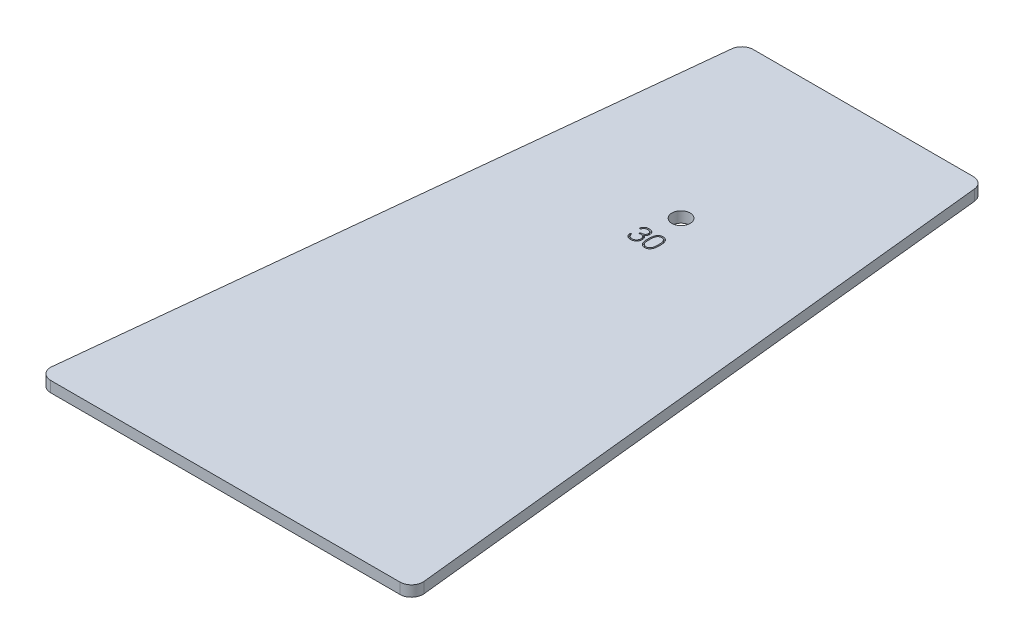
from build123d import *

# Parameters (mm, degrees)
BOSS_EXTRUDE1_DEPTH = 5.9944
SKETCH2_R           = 5.08
CUT_EXTRUDE1_DEPTH  = 371.66580688
CUT_EXTRUDE2_DEPTH  = 1.27
FILLET1_R           = 6.35


with BuildPart() as part:
    # Sketch1 → Boss-Extrude1 (new body)
    with BuildSketch(Plane(origin=(0, 0, 0), x_dir=(1, 0, 0), z_dir=(0, 1, 0))):
        Polygon((-67.056, 0), (67.056, 0), (104.43106606, -355.6), (-104.43106606, -355.6), align=None)
    extrude(amount=BOSS_EXTRUDE1_DEPTH)

    # Sketch2 → Cut-Extrude1 (cut, through all)
    with BuildSketch(Plane(origin=(0, 5.9944, 0), x_dir=(1, 0, 0), z_dir=(0, 1, 0))):
        with Locations(Location((0, -101.6, 0), (0, 0, 270))):
            Circle(SKETCH2_R)
    extrude(amount=-CUT_EXTRUDE1_DEPTH, mode=Mode.SUBTRACT)

    # Sketch3 → Cut-Extrude2 (cut)
    # profile 1 of 2: a face of its own
    with BuildSketch(Plane(origin=(0, 5.9944, 0), x_dir=(1, 0, 0), z_dir=(0, 1, 0))):
        with BuildLine():
            Line((-7.022352941, -123.068602941), (-6.225490196, -122.940980392))
            add(Edge.make_bspline(
                [(-6.225490196, -122.940980392), (-6.179159168, -123.113672862), (-6.090766085, -123.443145791), (-5.893002314, -123.893116495), (-5.653326656, -124.277637163), (-5.362735748, -124.592717125), (-5.023623342, -124.836847536), (-4.639439373, -125.009559122), (-4.210900555, -125.114996328), (-3.91023845, -125.126417063), (-3.753970588, -125.132352941)],
                knots=[0, 0, 0, 0, 1.185952709, 2.262630877, 3.250838064, 4.182033203, 5.090336224, 6.006134824, 6.963696984, 8, 8, 8, 8], degree=3))
            add(Edge.make_bspline(
                [(-3.753970588, -125.132352941), (-3.632311974, -125.129294556), (-3.396778139, -125.123373454), (-3.055537122, -125.062438499), (-2.739613531, -124.962860022), (-2.44676451, -124.825432627), (-2.1842903, -124.650311606), (-1.946018921, -124.449446481), (-1.740349543, -124.216617453), (-1.561552955, -123.957580623), (-1.416849481, -123.67148988), (-1.319432673, -123.358844856), (-1.253270796, -123.026773567), (-1.247865406, -122.79709633), (-1.245098039, -122.679509804)],
                knots=[0, 0, 0, 0, 1.112391676, 2.1536155, 3.159607968, 4.13650094, 5.103002125, 6.039177095, 6.980681787, 7.936725385, 8.913387604, 9.901293339, 10.925537295, 12, 12, 12, 12], degree=3))
            add(Edge.make_bspline(
                [(-1.245098039, -122.679509804), (-1.246477833, -122.600522673), (-1.249194291, -122.445017372), (-1.282695151, -122.219426954), (-1.327451026, -122.004938691), (-1.396057418, -121.803943287), (-1.489048405, -121.617377102), (-1.592290807, -121.437763337), (-1.722685616, -121.275763034), (-1.917485463, -121.076343486), (-2.20188298, -120.864069311), (-2.593312238, -120.677013181), (-3.036743624, -120.571255612), (-3.346678027, -120.557536056), (-3.508063725, -120.550392157)],
                knots=[0, 0, 0, 0, 0.811772018, 1.598169866, 2.341374635, 3.06367051, 3.774921333, 4.483283491, 5.190035732, 5.907028974, 7.347870326, 8.813481259, 10.340750343, 12, 12, 12, 12], degree=3))
            add(Edge.make_bspline(
                [(-3.508063725, -120.550392157), (-3.570458136, -120.553211168), (-3.706544321, -120.55935961), (-3.923959231, -120.600132932), (-4.170366976, -120.662415604), (-4.34159116, -120.719358558), (-4.43254902, -120.749607843)],
                knots=[0, 0, 0, 0, 0.788647944, 1.720091416, 2.788864984, 4, 4, 4, 4], degree=3))
            Line((-4.43254902, -120.749607843), (-4.339166667, -119.952745098))
            add(Edge.make_bspline(
                [(-4.339166667, -119.952745098), (-4.211491436, -119.950936246), (-3.969367573, -119.947505931), (-3.628545312, -119.922817047), (-3.330265399, -119.885264194), (-3.000954361, -119.807625151), (-2.646422183, -119.674933754), (-2.338322284, -119.490885157), (-2.131152352, -119.319361376), (-1.999871604, -119.178734556), (-1.890363345, -119.027511909), (-1.797899612, -118.86789123), (-1.729210893, -118.693480512), (-1.681209143, -118.508345213), (-1.647346728, -118.311468027), (-1.644829413, -118.176557999), (-1.643529412, -118.106887255)],
                knots=[0, 0, 0, 0, 1.451240035, 2.752137916, 3.88312397, 4.8644669, 6.592895175, 8.164668079, 8.918269139, 9.644320432, 10.345018353, 11.037025267, 11.735734825, 12.468177286, 13.208930344, 14, 14, 14, 14], degree=3))
            add(Edge.make_bspline(
                [(-1.643529412, -118.106887255), (-1.650509345, -117.983610579), (-1.66411437, -117.743324277), (-1.776821399, -117.401046126), (-1.96596106, -117.098265223), (-2.224892561, -116.840701279), (-2.536214171, -116.629020004), (-2.893116827, -116.475476622), (-3.290761262, -116.383395594), (-3.568768596, -116.372523158), (-3.713504902, -116.366862745)],
                knots=[0, 0, 0, 0, 0.976737165, 1.903819668, 2.824737209, 3.785549291, 4.781400884, 5.79567262, 6.852382064, 8, 8, 8, 8], degree=3))
            add(Edge.make_bspline(
                [(-3.713504902, -116.366862745), (-3.854039415, -116.371791417), (-4.12537475, -116.381307391), (-4.513600015, -116.467110178), (-4.865095935, -116.607514109), (-5.17833718, -116.807215106), (-5.453425475, -117.062995686), (-5.684159559, -117.378756965), (-5.883219335, -117.745828774), (-5.97729652, -118.018070701), (-6.02627451, -118.159803922)],
                knots=[0, 0, 0, 0, 1.063244, 2.052845668, 2.994088376, 3.916241797, 4.850371738, 5.821675903, 6.865931876, 8, 8, 8, 8], degree=3))
            Line((-6.02627451, -118.159803922), (-6.823137255, -118.007279412))
            add(Edge.make_bspline(
                [(-6.823137255, -118.007279412), (-6.795507069, -117.908263802), (-6.741395917, -117.714350929), (-6.638235475, -117.438000328), (-6.521644051, -117.180742974), (-6.39619017, -116.940453145), (-6.251608562, -116.72101519), (-6.09249965, -116.521665128), (-5.920815848, -116.340294928), (-5.736152715, -116.176736099), (-5.535865927, -116.032888014), (-5.320569348, -115.908978205), (-5.093111316, -115.802051694), (-4.850790057, -115.717919709), (-4.594226042, -115.653756692), (-4.324277726, -115.602706227), (-4.039873378, -115.575380927), (-3.846367498, -115.571816599), (-3.747745098, -115.57)],
                knots=[0, 0, 0, 0, 1.151946065, 2.255979367, 3.302323512, 4.316963809, 5.291200695, 6.243031876, 7.172717729, 8.087440795, 9.004158252, 9.931804679, 10.868449138, 11.817504777, 12.802032331, 13.83090576, 14.894497265, 16, 16, 16, 16], degree=3))
            add(Edge.make_bspline(
                [(-3.747745098, -115.57), (-3.640762164, -115.571134578), (-3.431393848, -115.573354975), (-3.126775673, -115.609879124), (-2.837313267, -115.662151303), (-2.56322677, -115.734994388), (-2.307835885, -115.836020829), (-2.068092886, -115.955485342), (-1.843673392, -116.09447094), (-1.638127063, -116.257539882), (-1.451493202, -116.43696588), (-1.287791849, -116.633237344), (-1.153981272, -116.848271897), (-1.040592711, -117.075951667), (-0.953424076, -117.320547421), (-0.891547543, -117.580392137), (-0.853370675, -117.855698039), (-0.848936049, -118.044506384), (-0.846666667, -118.141127451)],
                knots=[0, 0, 0, 0, 1.17304118, 2.295671334, 3.360722231, 4.399095647, 5.401139445, 6.368437906, 7.334999225, 8.291519651, 9.241514563, 10.171449278, 11.087342197, 12.013926289, 12.957350552, 13.929260155, 14.940316477, 16, 16, 16, 16], degree=3))
            add(Edge.make_bspline(
                [(-0.846666667, -118.141127451), (-0.850930579, -118.256558068), (-0.859217004, -118.480884227), (-0.92146644, -118.80693692), (-1.031917246, -119.107338687), (-1.182879951, -119.386249798), (-1.379156133, -119.63939225), (-1.614751692, -119.87329668), (-1.897947491, -120.078496141), (-2.108008459, -120.192705027), (-2.21627451, -120.251568627)],
                knots=[0, 0, 0, 0, 1.039153621, 2.01947583, 2.9741737, 3.910731788, 4.863782364, 5.848192228, 6.890951849, 8, 8, 8, 8], degree=3))
            add(Edge.make_bspline(
                [(-2.21627451, -120.251568627), (-2.076605097, -120.297135403), (-1.806544353, -120.385242005), (-1.440808729, -120.58262141), (-1.133728819, -120.830069975), (-0.877589438, -121.120636681), (-0.685343201, -121.463379276), (-0.543367347, -121.847361186), (-0.463326152, -122.278848212), (-0.453422318, -122.580608394), (-0.448235294, -122.738651961)],
                knots=[0, 0, 0, 0, 1.062050142, 2.053549488, 2.988468085, 3.904211674, 4.839582746, 5.816291321, 6.856306669, 8, 8, 8, 8], degree=3))
            add(Edge.make_bspline(
                [(-0.448235294, -122.738651961), (-0.451291104, -122.855014514), (-0.457288258, -123.083380833), (-0.502478751, -123.417657966), (-0.571377301, -123.735672586), (-0.676738803, -124.034186175), (-0.807153117, -124.316876649), (-0.969873616, -124.581571508), (-1.160792719, -124.828915505), (-1.379109975, -125.056141259), (-1.620394131, -125.260207248), (-1.881430984, -125.438882746), (-2.157648032, -125.592689762), (-2.454217209, -125.713387607), (-2.766248092, -125.811407575), (-3.097158213, -125.877287666), (-3.444464768, -125.924350599), (-3.682208492, -125.927569671), (-3.80377451, -125.929215686)],
                knots=[0, 0, 0, 0, 1.072071369, 2.103984363, 3.103853144, 4.0655425, 5.015271866, 5.96812527, 6.922560812, 7.8897021, 8.866767387, 9.829597087, 10.801124953, 11.774298562, 12.775446883, 13.810677578, 14.880528982, 16, 16, 16, 16], degree=3))
            add(Edge.make_bspline(
                [(-3.80377451, -125.929215686), (-3.91174159, -125.926380954), (-4.121899618, -125.920863145), (-4.430362418, -125.890720053), (-4.721742092, -125.834404654), (-4.998637664, -125.757502141), (-5.256115535, -125.653715683), (-5.499932286, -125.53163902), (-5.726545074, -125.385760493), (-5.936578214, -125.215939691), (-6.130179855, -125.024934126), (-6.30864799, -124.813174484), (-6.467563012, -124.575955577), (-6.614344715, -124.318893999), (-6.741149501, -124.036717645), (-6.852809332, -123.733950277), (-6.950758779, -123.410032489), (-6.998114815, -123.184193544), (-7.022352941, -123.068602941)],
                knots=[0, 0, 0, 0, 1.092142754, 2.125856941, 3.130178579, 4.090157876, 5.027443808, 5.933183123, 6.844256067, 7.747255784, 8.659958934, 9.591056537, 10.542798976, 11.543715938, 12.581523217, 13.667244669, 14.806031458, 16, 16, 16, 16], degree=3))
        make_face()
    # profile 2 of 2: a face of its own
    with BuildSketch(Plane(origin=(0, 5.9944, 0), x_dir=(1, 0, 0), z_dir=(0, 1, 0))):
        with BuildLine():
            add(Edge.make_bspline(
                [(7.321176471, -120.755833333), (7.318828398, -120.964435203), (7.314268428, -121.369541156), (7.278053355, -121.956745016), (7.212590307, -122.503235643), (7.123658685, -123.008755237), (7.008266172, -123.474678786), (6.871087333, -123.902056716), (6.702092819, -124.287425995), (6.508215245, -124.632617465), (6.291747836, -124.939879658), (6.045192851, -125.205053414), (5.774903263, -125.430333986), (5.47658793, -125.612983557), (5.154255704, -125.75891836), (4.803074469, -125.854617169), (4.428855706, -125.921386338), (4.17035965, -125.926554175), (4.037230392, -125.929215686)],
                knots=[0, 0, 0, 0, 1.444951835, 2.806104229, 4.07292158, 5.255788138, 6.359234241, 7.395665143, 8.361159583, 9.268708362, 10.134304339, 10.95819393, 11.769860228, 12.563733626, 13.374508403, 14.211708464, 15.079003648, 16, 16, 16, 16], degree=3))
            add(Edge.make_bspline(
                [(4.037230392, -125.929215686), (3.904173743, -125.926129436), (3.644961099, -125.920116997), (3.27017657, -125.859085315), (2.920411161, -125.763594373), (2.59640029, -125.625895969), (2.300139806, -125.446021212), (2.024069589, -125.233082993), (1.778627689, -124.975727427), (1.560171839, -124.679785297), (1.365195047, -124.347714828), (1.20253453, -123.973246068), (1.058366082, -123.562916679), (0.945634561, -123.112374896), (0.854092493, -122.625055928), (0.795691583, -122.097466824), (0.752427723, -121.531621273), (0.748884772, -121.140869167), (0.747058824, -120.939485294)],
                knots=[0, 0, 0, 0, 0.942187573, 1.835510922, 2.682899358, 3.50644207, 4.321041037, 5.132947656, 5.970162763, 6.831912057, 7.734836617, 8.692673853, 9.720484412, 10.813675431, 11.980358204, 13.231647047, 14.573260056, 16, 16, 16, 16], degree=3))
            add(Edge.make_bspline(
                [(0.747058824, -120.939485294), (0.749189738, -120.709081181), (0.753301018, -120.264550974), (0.791785956, -119.623892076), (0.848921011, -119.033607435), (0.931327178, -118.493626742), (1.041809864, -118.002956136), (1.18209133, -117.562748274), (1.344352733, -117.168906906), (1.542969603, -116.826611164), (1.76640963, -116.527719309), (2.011736134, -116.265404707), (2.288722816, -116.05041743), (2.588716504, -115.873144616), (2.914180915, -115.735469097), (3.266151279, -115.640569114), (3.642854433, -115.578856283), (3.90312556, -115.573011518), (4.037230392, -115.57)],
                knots=[0, 0, 0, 0, 1.545108237, 2.981054794, 4.302900454, 5.52134946, 6.64223763, 7.672189641, 8.617001291, 9.493094031, 10.318410963, 11.115795503, 11.893970542, 12.661367534, 13.447190288, 14.255881535, 15.101342067, 16, 16, 16, 16], degree=3))
            add(Edge.make_bspline(
                [(4.037230392, -115.57), (4.170238627, -115.57448963), (4.428282356, -115.583199774), (4.804192318, -115.642018007), (5.152618043, -115.745772402), (5.478653289, -115.884356647), (5.772542755, -116.073295118), (6.047681503, -116.293496105), (6.289327541, -116.562467111), (6.510315761, -116.867199073), (6.701841879, -117.215226558), (6.869820244, -117.601739646), (7.009467972, -118.029371708), (7.123413066, -118.496780378), (7.21266615, -119.005311375), (7.277684225, -119.552884468), (7.314472673, -120.141074122), (7.318890361, -120.546189931), (7.321176471, -120.755833333)],
                knots=[0, 0, 0, 0, 0.919968977, 1.784793451, 2.622728724, 3.429378823, 4.225844794, 5.031728358, 5.85964663, 6.718105312, 7.630541726, 8.601153045, 9.629202519, 10.737948011, 11.926092541, 13.198121829, 14.550055913, 16, 16, 16, 16], degree=3))
        make_face()
        with BuildLine():
            add(Edge.make_bspline(
                [(6.524313725, -120.768284314), (6.522566947, -120.59082563), (6.519183425, -120.247086842), (6.491882586, -119.747351272), (6.442379883, -119.282006526), (6.374689104, -118.850591154), (6.287787289, -118.454473729), (6.184085269, -118.091152232), (6.054789642, -117.764549081), (5.914753741, -117.468482457), (5.746577036, -117.21145005), (5.563889756, -116.983709924), (5.356631682, -116.79434266), (5.134096525, -116.633668508), (4.887159424, -116.51702345), (4.624573174, -116.42744118), (4.339914631, -116.378499272), (4.144272117, -116.370819959), (4.043455882, -116.366862745)],
                knots=[0, 0, 0, 0, 1.502278276, 2.909924168, 4.234983773, 5.462469173, 6.604815465, 7.666614396, 8.656743616, 9.57599474, 10.43362925, 11.251287335, 12.040715275, 12.803499886, 13.565626727, 14.343386511, 15.146333119, 16, 16, 16, 16], degree=3))
            add(Edge.make_bspline(
                [(4.043455882, -116.366862745), (3.938447052, -116.369409337), (3.734422845, -116.374357173), (3.43835687, -116.425549656), (3.163244621, -116.509328168), (2.90892764, -116.62546025), (2.673837753, -116.772323146), (2.465862577, -116.959962497), (2.272440236, -117.175944485), (2.105615234, -117.430931462), (1.958401995, -117.71853329), (1.838162718, -118.042916058), (1.738143905, -118.401926091), (1.665875136, -118.800267442), (1.610637384, -119.239896883), (1.570198504, -119.724849093), (1.550557152, -120.257632824), (1.546194025, -120.628198528), (1.543921569, -120.82120098)],
                knots=[0, 0, 0, 0, 0.869467109, 1.689308758, 2.480750345, 3.246411928, 4.000153033, 4.767743238, 5.559605047, 6.396624794, 7.284891774, 8.231849658, 9.258192498, 10.369472511, 11.583108734, 12.929054675, 14.400553601, 16, 16, 16, 16], degree=3))
            add(Edge.make_bspline(
                [(1.543921569, -120.82120098), (1.544614632, -120.988289367), (1.54595406, -121.311207558), (1.570315432, -121.778131708), (1.598441181, -122.210377927), (1.645028029, -122.609499828), (1.709082826, -122.979104893), (1.796740701, -123.322117953), (1.902442711, -123.64204798), (2.027679077, -123.937897338), (2.18133626, -124.206925847), (2.364747317, -124.444835267), (2.580966733, -124.649942715), (2.82339308, -124.825742486), (3.097933318, -124.96336255), (3.398653863, -125.062824592), (3.726651153, -125.123356927), (3.95395607, -125.129287098), (4.071470588, -125.132352941)],
                knots=[0, 0, 0, 0, 1.411809826, 2.728490499, 3.95043818, 5.071756233, 6.122676174, 7.117949067, 8.060697316, 8.967954545, 9.828234386, 10.671864258, 11.496693245, 12.338635446, 13.193491276, 14.080783746, 15.007783125, 16, 16, 16, 16], degree=3))
            add(Edge.make_bspline(
                [(4.071470588, -125.132352941), (4.170329033, -125.130072963), (4.364367231, -125.125597848), (4.644218388, -125.069712213), (4.907756322, -124.987576413), (5.148049832, -124.862984482), (5.372323269, -124.710857365), (5.572547405, -124.519087844), (5.758725654, -124.297778208), (5.918122592, -124.036648789), (6.062406119, -123.745178799), (6.186127809, -123.4196766), (6.291039197, -123.06045838), (6.37874373, -122.667596662), (6.4407328, -122.240695517), (6.492645246, -121.781020892), (6.51900758, -121.286348012), (6.522506852, -120.944697746), (6.524313725, -120.768284314)],
                knots=[0, 0, 0, 0, 0.843506666, 1.655625022, 2.429524786, 3.194843558, 3.95975131, 4.737602927, 5.556133668, 6.424576934, 7.344541811, 8.332537572, 9.395844817, 10.540307741, 11.769239909, 13.080349428, 14.492418622, 16, 16, 16, 16], degree=3))
        make_face(mode=Mode.SUBTRACT)
    extrude(amount=-CUT_EXTRUDE2_DEPTH, mode=Mode.SUBTRACT)

    # Fillet1
    fillet1_edges = [part.edges().sort_by_distance(p)[0] for p in [
        (104.43106606, 2.9972, 355.6),
        (-104.43106606, 2.9972, 355.6),
        (-67.056, 2.9972, 0),
        (67.056, 2.9972, 0),
    ]]
    fillet(fillet1_edges, radius=FILLET1_R)


solid = part.part
